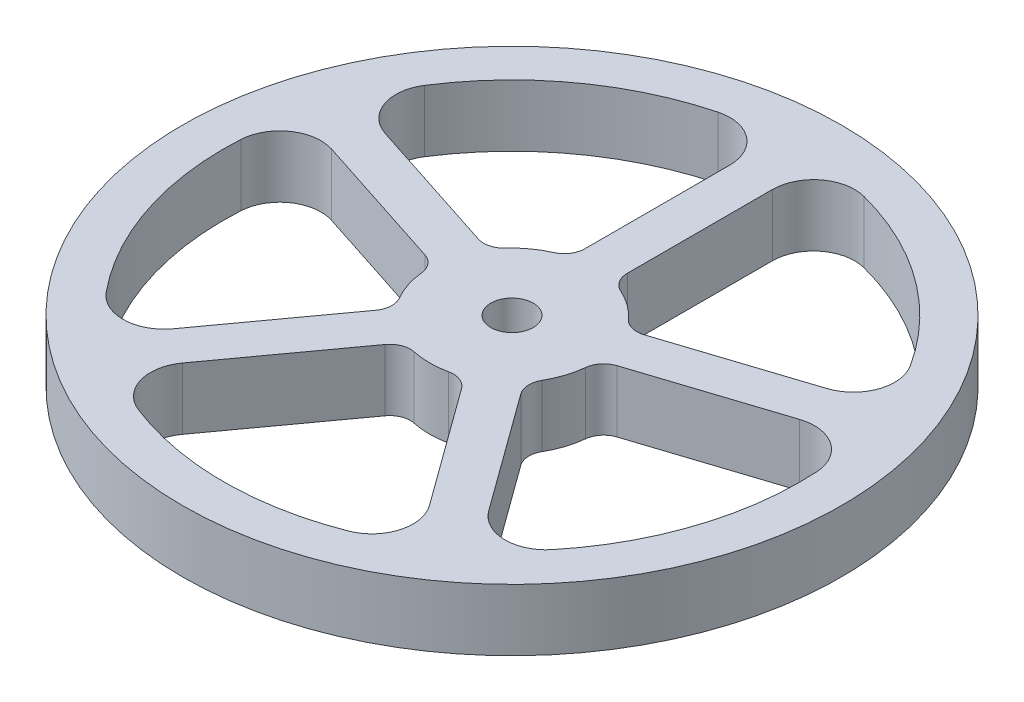
from build123d import *

# Parameters (mm, degrees)
SKETCH1_R           = 40
SKETCH1_R_2         = 2.575
BOSS_EXTRUDE1_DEPTH = 7.5


with BuildPart() as part:
    # Sketch1 → Boss-Extrude1 (new body)
    with BuildSketch(Plane(origin=(0, 0, 0), x_dir=(1, 0, 0), z_dir=(0, 1, 0))):
        with Locations(Location((0, 0, 0), (0, 0, 270))):
            Circle(SKETCH1_R)
        with Locations(Location((0, 0, 0), (0, 0, 270))):
            Circle(SKETCH1_R_2, mode=Mode.SUBTRACT)
        with BuildLine():
            Line((-2.575, 11.423413457), (-2.575, 29.027906831))
            ThreePointArc((-2.575, 29.027906831), (-4.518245185, 32.984704779), (-8.8375, 33.865891303))
            ThreePointArc((-8.8375, 33.865891303), (-20.57248383, 28.315594803), (-29.477438916, 18.870097905))
            ThreePointArc((-29.477438916, 18.870097905), (-29.974103871, 14.489940856), (-26.811461186, 11.419087051))
            Line((-26.811461186, 11.419087051), (-10.068593046, 5.978999421))
            ThreePointArc((-10.068593046, 5.978999421), (-8.648029574, 5.942087171), (-7.436840448, 6.68531257))
            ThreePointArc((-7.436840448, 6.68531257), (-5.877852523, 8.090169944), (-4.06, 9.138730765))
            ThreePointArc((-4.06, 9.138730765), (-2.978872618, 10.060970797), (-2.575, 11.423413457))
        make_face(mode=Mode.SUBTRACT)
        with BuildLine():
            Line((2.575, 11.423413457), (2.575, 29.027906831))
            ThreePointArc((2.575, 29.027906831), (4.518245185, 32.984704779), (8.8375, 33.865891303))
            ThreePointArc((8.8375, 33.865891303), (20.57248383, 28.315594803), (29.477438916, 18.870097905))
            ThreePointArc((29.477438916, 18.870097905), (29.974103871, 14.489940856), (26.811461186, 11.419087051))
            Line((26.811461186, 11.419087051), (10.068593046, 5.978999421))
            ThreePointArc((10.068593046, 5.978999421), (8.648029574, 5.942087171), (7.436840448, 6.68531257))
            ThreePointArc((7.436840448, 6.68531257), (5.877852523, 8.090169944), (4.06, 9.138730765))
            ThreePointArc((4.06, 9.138730765), (2.978872618, 10.060970797), (2.575, 11.423413457))
        make_face(mode=Mode.SUBTRACT)
        with BuildLine():
            Line((11.660030567, 1.081058362), (28.402898707, 6.521145993))
            ThreePointArc((28.402898707, 6.521145993), (32.766532965, 5.895727806), (34.939314292, 2.06017398))
            ThreePointArc((34.939314292, 2.06017398), (33.28697807, -10.815594803), (27.055559151, -22.203529427))
            ThreePointArc((27.055559151, -22.203529427), (23.04326016, -24.029428835), (19.145394301, -21.970522913))
            Line((19.145394301, -21.970522913), (8.797732721, -7.728188595))
            ThreePointArc((8.797732721, -7.728188595), (8.323648831, -6.388558961), (8.656220166, -5.006980372))
            ThreePointArc((8.656220166, -5.006980372), (9.510565163, -3.090169944), (9.946058442, -1.037266343))
            ThreePointArc((9.946058442, -1.037266343), (10.4890741, 0.275934741), (11.660030567, 1.081058362))
        make_face(mode=Mode.SUBTRACT)
        with BuildLine():
            Line((4.6312952, -10.755282645), (14.97895678, -24.997616962))
            ThreePointArc((14.97895678, -24.997616962), (15.732585881, -29.340944607), (12.756183776, -32.592633761))
            ThreePointArc((12.756183776, -32.592633761), (0, -35), (-12.756183776, -32.592633761))
            ThreePointArc((-12.756183776, -32.592633761), (-15.732585881, -29.340944607), (-14.97895678, -24.997616962))
            Line((-14.97895678, -24.997616962), (-4.6312952, -10.755282645))
            ThreePointArc((-4.6312952, -10.755282645), (-3.503731686, -9.890433748), (-2.087002171, -9.77979662))
            ThreePointArc((-2.087002171, -9.77979662), (0, -10), (2.087002171, -9.77979662))
            ThreePointArc((2.087002171, -9.77979662), (3.503731686, -9.890433748), (4.6312952, -10.755282645))
        make_face(mode=Mode.SUBTRACT)
        with BuildLine():
            Line((-8.797732721, -7.728188595), (-19.145394301, -21.970522913))
            ThreePointArc((-19.145394301, -21.970522913), (-23.04326016, -24.029428835), (-27.055559151, -22.203529427))
            ThreePointArc((-27.055559151, -22.203529427), (-33.28697807, -10.815594803), (-34.939314292, 2.06017398))
            ThreePointArc((-34.939314292, 2.06017398), (-32.766532965, 5.895727806), (-28.402898707, 6.521145993))
            Line((-28.402898707, 6.521145993), (-11.660030567, 1.081058362))
            ThreePointArc((-11.660030567, 1.081058362), (-10.4890741, 0.275934741), (-9.946058442, -1.037266343))
            ThreePointArc((-9.946058442, -1.037266343), (-9.510565163, -3.090169944), (-8.656220166, -5.006980372))
            ThreePointArc((-8.656220166, -5.006980372), (-8.323648831, -6.388558961), (-8.797732721, -7.728188595))
        make_face(mode=Mode.SUBTRACT)
    extrude(amount=BOSS_EXTRUDE1_DEPTH)


solid = part.part
